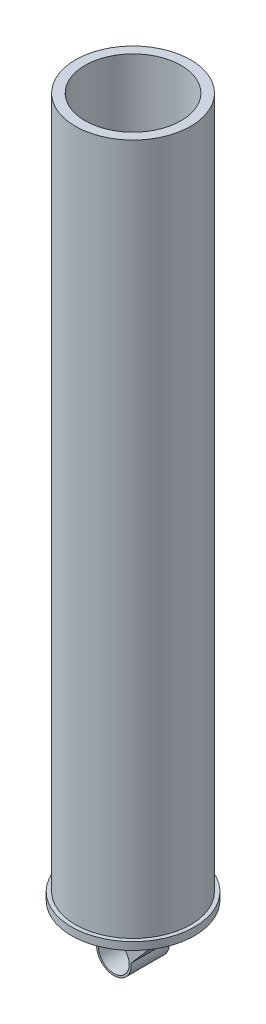
from build123d import *

# Parameters (mm, degrees)
SKETCH1_R           = 150
SKETCH1_R_2         = 125
BOSS_EXTRUDE1_DEPTH = 1800
SKETCH2_R           = 160
BOSS_EXTRUDE2_DEPTH = 20
BOSS_EXTRUDE3_DEPTH = 50


with BuildPart() as part:
    # Sketch1 → Boss-Extrude1 (new body)
    with BuildSketch(Plane(origin=(0, 0, 0), x_dir=(1, 0, 0), z_dir=(0, 1, 0))):
        with Locations(Location((0, 0, 0), (0, 0, 270))):
            Circle(SKETCH1_R)
        with Locations(Location((0, 0, 0), (0, 0, 270))):
            Circle(SKETCH1_R_2, mode=Mode.SUBTRACT)
    extrude(amount=BOSS_EXTRUDE1_DEPTH)

    # Sketch2 → Boss-Extrude2 (add)
    with BuildSketch(Plane.XZ):
        with Locations(Location((0, 0, 0), (0, 0, 270))):
            Circle(SKETCH2_R)
    extrude(amount=BOSS_EXTRUDE2_DEPTH)

    # Sketch4 → Boss-Extrude3 (add, symmetric)
    with BuildSketch(Plane.XY):
        with BuildLine():
            ThreePointArc((40, -119.791280473), (0, -159.791280473), (-40, -119.791280473))
            Line((-40, -119.791280473), (-44.657114197, -114.246719929))
            ThreePointArc((-44.657114197, -114.246719929), (-2.777576385, -164.70547722), (45, -119.791280473))
            ThreePointArc((45, -119.791280473), (44.918765065, -117.088588293), (44.675353555, -114.395654025))
            Line((44.675353555, -114.395654025), (40, -119.791280473))
        make_face()
        with BuildLine():
            Line((-44.657114197, -114.246719929), (-40, -119.791280473))
            ThreePointArc((-40, -119.791280473), (0, -79.791280473), (40, -119.791280473))
            Line((40, -119.791280473), (44.675353555, -114.395654025))
            ThreePointArc((44.675353555, -114.395654025), (0.075023395, -74.791343012), (-44.657114197, -114.246719929))
        make_face()
        with BuildLine():
            Line((-123.818976335, -20), (-44.657114197, -114.246719929))
            ThreePointArc((-44.657114197, -114.246719929), (0.075023395, -74.791343012), (44.675353555, -114.395654025))
            Line((44.675353555, -114.395654025), (126.469944209, -20))
            Line((126.469944209, -20), (-123.818976335, -20))
        make_face()
    extrude(amount=BOSS_EXTRUDE3_DEPTH, both=True)


solid = part.part
